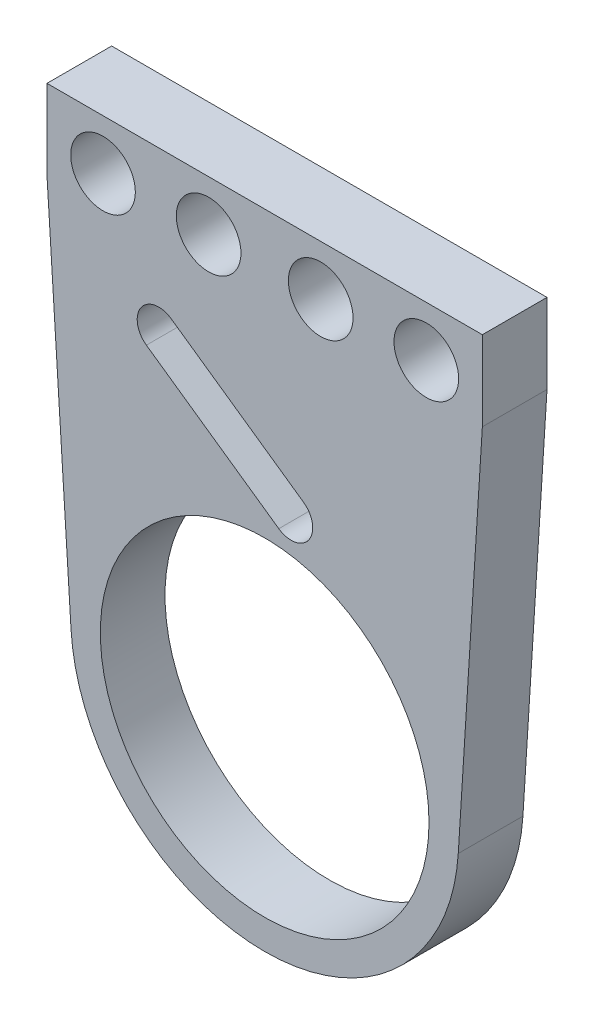
from build123d import *

# Parameters (mm, degrees)
SKETCH1_R               = 7.95
SKETCH1_R_2             = 3
MAIN_BODY_LINK_B2_DEPTH = 6
CUT_EXTRUDE1_REACH      = 48.699
SKETCH2_R               = 1.5
CUT_EXTRUDE2_DEPTH      = 47.698679231
SKETCH4_R               = 15.25
CUT_EXTRUDE3_DEPTH      = 47.698679231


with BuildPart() as part:
    # Sketch1 → Main Body Link B2 (new body)
    with BuildSketch(Plane.XY):
        with BuildLine():
            Line((0, 41.674052381), (20.2, 41.674052381))
            Line((20.2, 41.674052381), (20.2, 34.274052381))
            Line((20.2, 34.274052381), (17.964224051, -1.134307826))
            ThreePointArc((17.964224051, -1.134307826), (0, -18), (-17.964224051, -1.134307826))
            Line((-17.964224051, -1.134307826), (-20.2, 34.274052381))
            Line((-20.2, 34.274052381), (-20.2, 41.674052381))
            Line((-20.2, 41.674052381), (0, 41.674052381))
        make_face()
        Circle(SKETCH1_R, mode=Mode.SUBTRACT)
        with Locations((-15, 37.024052381)):
            Circle(SKETCH1_R_2, mode=Mode.SUBTRACT)
        with Locations((-5.2, 37.024052381)):
            Circle(SKETCH1_R_2, mode=Mode.SUBTRACT)
        with Locations((5.2, 37.024052381)):
            Circle(SKETCH1_R_2, mode=Mode.SUBTRACT)
        with Locations((15, 37.024052381)):
            Circle(SKETCH1_R_2, mode=Mode.SUBTRACT)
    extrude(amount=MAIN_BODY_LINK_B2_DEPTH)

    # Sketch2 → Cut-Extrude1 (cut, up to next)
    with BuildSketch(Plane.XY.offset(6), mode=Mode.PRIVATE) as cut_extrude1_sk1:
        with Locations((-11.5, 0)):
            Circle(SKETCH2_R)
    cut_extrude1_tool1 = extrude(cut_extrude1_sk1.sketch, amount=-CUT_EXTRUDE1_REACH, mode=Mode.PRIVATE) & part.part
    # Sketch2 → Cut-Extrude1 (cut, up to next)
    with BuildSketch(Plane.XY.offset(6), mode=Mode.PRIVATE) as cut_extrude1_sk2:
        with Locations((11.5, 0)):
            Circle(SKETCH2_R)
    cut_extrude1_tool2 = extrude(cut_extrude1_sk2.sketch, amount=-CUT_EXTRUDE1_REACH, mode=Mode.PRIVATE) & part.part
    add(cut_extrude1_tool1.solids().sort_by_distance((-11.5, 0, 6))[0], mode=Mode.SUBTRACT)
    add(cut_extrude1_tool2.solids().sort_by_distance((11.5, 0, 6))[0], mode=Mode.SUBTRACT)

    # Sketch3 → Cut-Extrude2 (cut, through all)
    with BuildSketch(Plane.XY.offset(6)):
        with BuildLine():
            Line((-8.682671659, 28.521221325), (3.604609006, 19.91757478))
            ThreePointArc((3.604609006, 19.91757478), (4.095760221, 17.132117818), (1.31030326, 16.640966602))
            Line((1.31030326, 16.640966602), (-10.976977404, 25.244613148))
            ThreePointArc((-10.976977404, 25.244613148), (-11.46812862, 28.030070109), (-8.682671659, 28.521221325))
        make_face()
    extrude(amount=-CUT_EXTRUDE2_DEPTH, mode=Mode.SUBTRACT)

    # Sketch4 → Cut-Extrude3 (cut, through all)
    with BuildSketch(Plane.XY.offset(6)):
        Circle(SKETCH4_R)
    extrude(amount=-CUT_EXTRUDE3_DEPTH, mode=Mode.SUBTRACT)


solid = part.part
